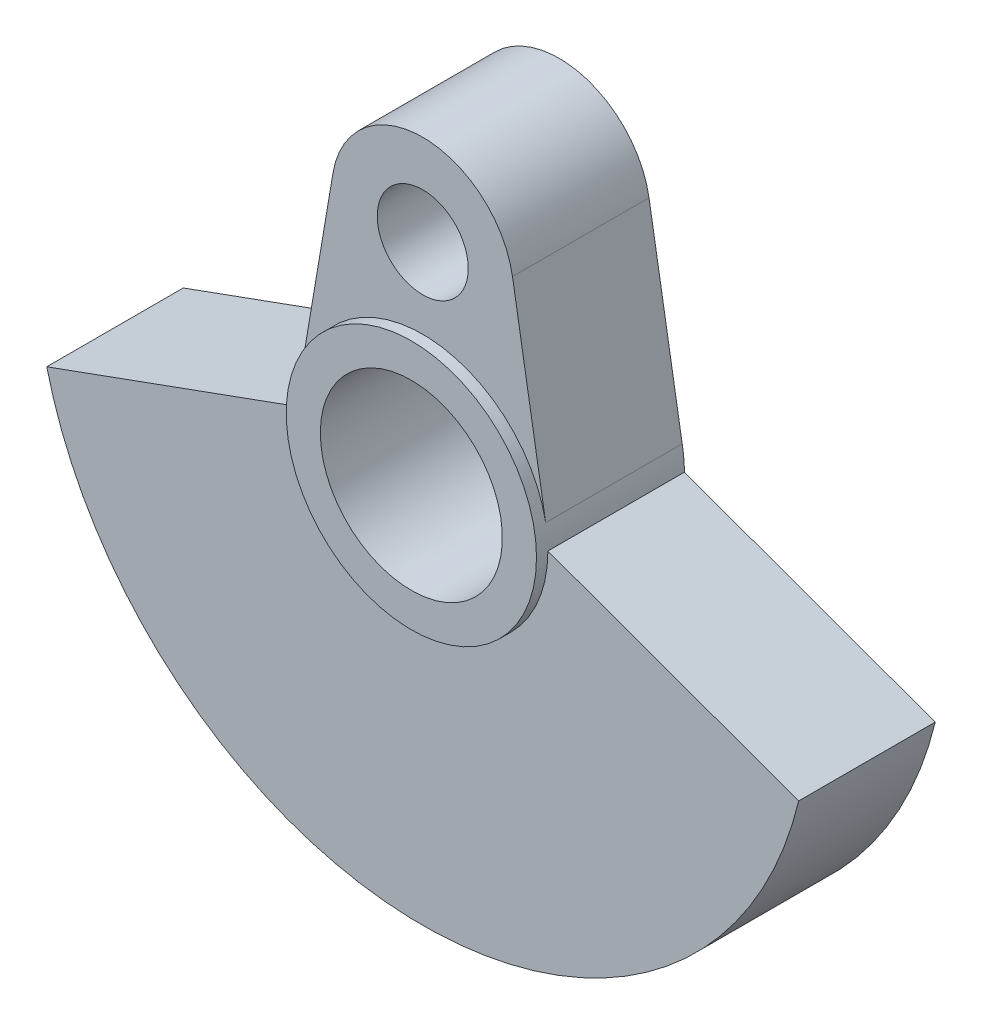
from build123d import *

# Parameters (mm, degrees)
BOSS_EXTRUDE1_DEPTH   = 3
SKETCH1_R             = 2
BOSS_EXTRUDE1_2_DEPTH = 3
BOSS_EXTRUDE4_START   = 3.5
SKETCH1_6_R           = 5.5
SKETCH1_6_R_2         = 4
BOSS_EXTRUDE4_DEPTH   = 6.5
SCALE1_SCALE          = 1.5


with BuildPart() as part:
    # Sketch1 → Boss-Extrude1 (new, symmetric)
    with BuildSketch(Plane.XY):
        with BuildLine():
            Line((-5.5, 0), (-16.522711642, -4))
            ThreePointArc((-16.522711642, -4), (0, -17), (16.522711642, -4))
            Line((16.522711642, -4), (5.5, 0))
            ThreePointArc((5.5, 0), (0, -5.5), (-5.5, 0))
        make_face()
    extrude(amount=BOSS_EXTRUDE1_DEPTH, both=True)



with BuildPart() as body_2:
    # Sketch1 → Boss-Extrude1 2 (new, symmetric)
    with BuildSketch(Plane.XY):
        with BuildLine():
            Line((-3.944053189, 9.666666667), (-5.423073135, 0.916666667))
            ThreePointArc((-5.423073135, 0.916666667), (-0.058211757, 5.499691936), (5.402455316, 1.03125))
            Line((5.402455316, 1.03125), (3.944146954, 9.666111708))
            ThreePointArc((3.944146954, 9.666111708), (0.000281412, 12.99999999), (-3.944053189, 9.666666667))
        make_face()
        with Locations((0, 9)):
            Circle(SKETCH1_R, mode=Mode.SUBTRACT)
    extrude(amount=BOSS_EXTRUDE1_2_DEPTH, both=True)


with BuildPart() as part_1:
    add(part.part)

    add(body_2.part)  # Boss-Extrude4 merges body 2
    # Sketch1<6> → Boss-Extrude4 (add)
    with BuildSketch(Plane.XY.offset(BOSS_EXTRUDE4_START)):
        Circle(SKETCH1_6_R)
        with Locations(Location((0, 0, 0), (0, 0, 180))):
            Circle(SKETCH1_6_R_2, mode=Mode.SUBTRACT)
    extrude(amount=-BOSS_EXTRUDE4_DEPTH)


with BuildPart() as part_2:
    # Scale1: scaled about (-5.8229e-05, -5.841049103, 0.026355908)
    add(part_1.part.scale(SCALE1_SCALE).moved(Location((2.9115e-05, 2.920524551, -0.013177954))))


solid = part_2.part
